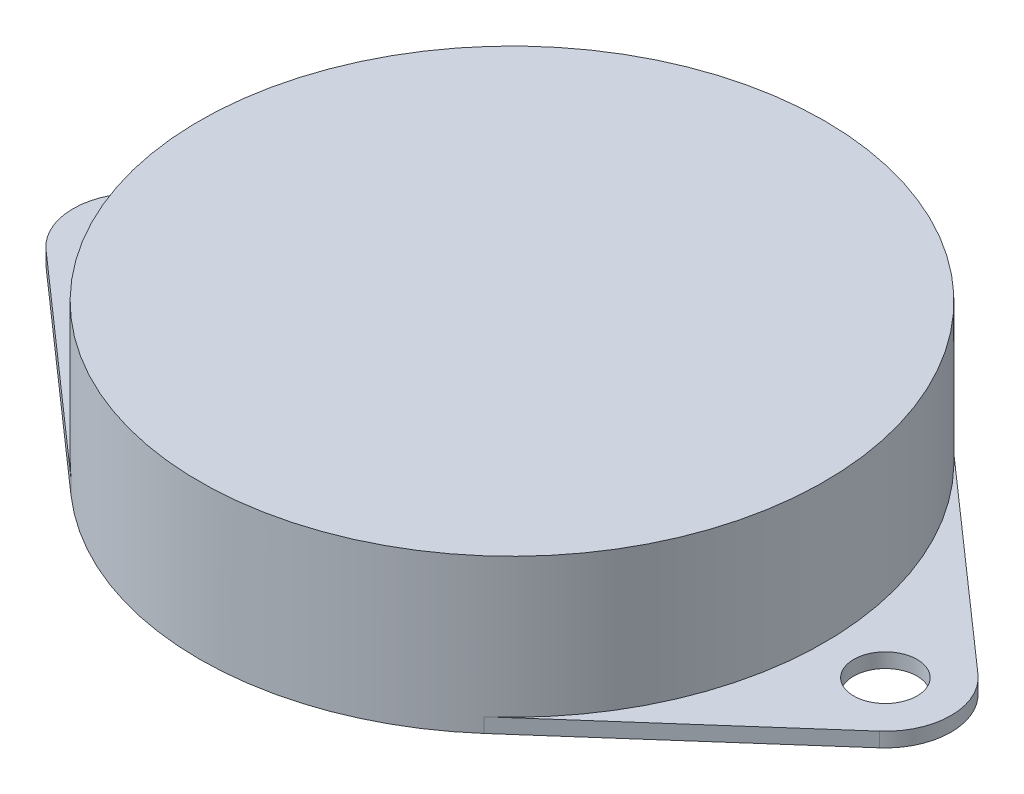
from build123d import *
from build123d.topology import SkipClean

# Parameters (mm, degrees)
SKETCH1_R           = 1.778
BOSS_EXTRUDE1_DEPTH = 0.8128
SKETCH2_R           = 17.5387
BOSS_EXTRUDE2_DEPTH = 7.8232
SKETCH3_R           = 5.0165
BOSS_EXTRUDE3_DEPTH = 1.524
SKETCH5_R           = 1.016
BOSS_EXTRUDE4_DEPTH = 3.81
SKETCH6_R           = 4.191
BOSS_EXTRUDE5_DEPTH = 3.302


with BuildPart() as part:
    # Sketch1 → Boss-Extrude1 (new body)
    with BuildSketch(Plane(origin=(0, 0, 0), x_dir=(1, 0, 0), z_dir=(0, 1, 0))):
        with BuildLine():
            Line((-23.390244242, 2.762982895), (-11.59680103, 13.157515098))
            ThreePointArc((-11.59680103, 13.157515098), (0, 17.5387), (11.59680103, 13.157515098))
            Line((11.59680103, 13.157515098), (23.390244242, 2.762982895))
            ThreePointArc((23.390244242, 2.762982895), (24.638, 0), (23.390244242, -2.762982895))
            Line((23.390244242, -2.762982895), (11.59680103, -13.157515098))
            ThreePointArc((11.59680103, -13.157515098), (0, -17.5387), (-11.59680103, -13.157515098))
            Line((-11.59680103, -13.157515098), (-23.390244242, -2.762982895))
            ThreePointArc((-23.390244242, -2.762982895), (-24.638, 0), (-23.390244242, 2.762982895))
        make_face()
        with Locations(Location((-20.955, 0, 0), (0, 0, 270))):
            Circle(SKETCH1_R, mode=Mode.SUBTRACT)
        with Locations(Location((20.955, 0, 0), (0, 0, 90))):
            Circle(SKETCH1_R, mode=Mode.SUBTRACT)
    extrude(amount=BOSS_EXTRUDE1_DEPTH)

    # Sketch2 → Boss-Extrude2 (add)
    with SkipClean():  # the faces are left unmerged after this step: merging them gives an invalid solid
        with BuildSketch(Plane(origin=(0, 0.8128, 0), x_dir=(1, 0, 0), z_dir=(0, 1, 0))):
            with Locations(Location((0, 0, 0), (0, 0, 90))):
                Circle(SKETCH2_R)
        extrude(amount=BOSS_EXTRUDE2_DEPTH)

    # Sketch3 → Boss-Extrude3 (add)
    with SkipClean():  # the faces are left unmerged after this step: merging them gives an invalid solid
        with BuildSketch(Plane(origin=(0, 0, 0), x_dir=(1, 0, 0), z_dir=(0, 1, 0))):
            with Locations(Location((0, 0, 0), (0, 0, 270))):
                Circle(SKETCH3_R)
        extrude(amount=-BOSS_EXTRUDE3_DEPTH)

    # Sketch5 → Boss-Extrude4 (add)
    with SkipClean():  # the faces are left unmerged after this step: merging them gives an invalid solid
        with BuildSketch(Plane.XZ.offset(1.524)):
            with Locations(Location((0, 0, 0), (0, 0, 90))):
                Circle(SKETCH5_R)
        extrude(amount=BOSS_EXTRUDE4_DEPTH)

    # Sketch6 → Boss-Extrude5 (add)
    with SkipClean():  # the faces are left unmerged after this step: merging them gives an invalid solid
        with BuildSketch(Plane.XZ.offset(5.334)):
            with Locations(Location((0, 0, 0), (0, 0, 270))):
                Circle(SKETCH6_R)
        extrude(amount=BOSS_EXTRUDE5_DEPTH)


solid = part.part
